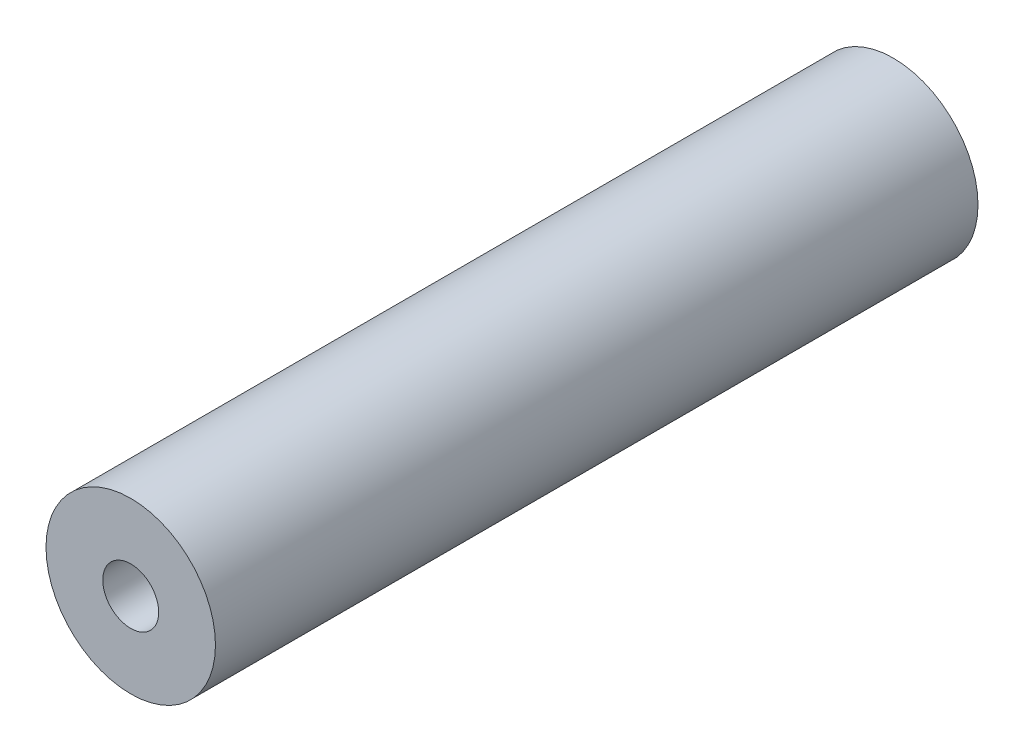
from build123d import *

# Parameters (mm, degrees)
SKETCH_1_R      = 5
EXTRUDE_1_DEPTH = 45


with BuildPart() as part:
    # ｽｹｯﾁ1 → ﾎﾞｽ - 押し出し1 (new body)
    with BuildSketch(Plane.XY):
        with Locations(Location((0, 0, 0), (0, 0, 180))):
            Circle(SKETCH_1_R)
    extrude(amount=EXTRUDE_1_DEPTH)

    # ｽｹｯﾁ3 → M4x0.7 ねじ穴1 (revolve, cut)
    with BuildSketch(Plane(origin=(0, 0, 45), x_dir=(0, -1, 0), z_dir=(1, 0, 0))):
        Polygon((0, 0), (0, 15.991420021), (1.65, 15), (1.65, 0), align=None)
    m4x0_7_1 = revolve(axis=Axis((0, 0, 51.35), (0, 0, -1)), mode=Mode.SUBTRACT)

    # ﾐﾗｰ1: M4x0.7 ねじ穴1 across plane
    add(m4x0_7_1.mirror(Plane.XY.offset(22.5)), mode=Mode.SUBTRACT)


solid = part.part
